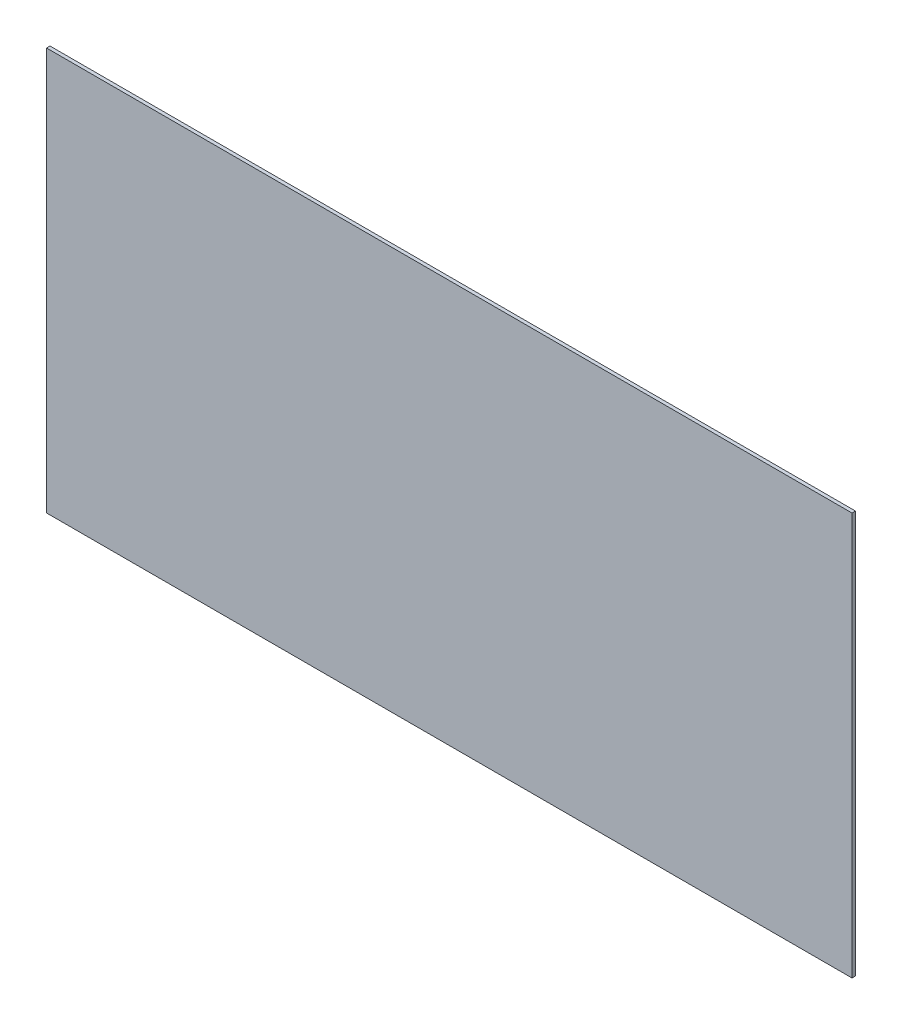
from build123d import *

# Parameters (mm, degrees)
IZIM1_W                     = 700
IZIM1_H                     = 350
Y_KSEKLIK_EKSTR_ZYON1_DEPTH = 3


with BuildPart() as part:
    # Çizim1 → Yükseklik-Ekstrüzyon1 (new body)
    with BuildSketch(Plane.XY):
        with Locations((86.06557377, 0)):
            Rectangle(IZIM1_W, IZIM1_H)
    extrude(amount=Y_KSEKLIK_EKSTR_ZYON1_DEPTH)


solid = part.part
